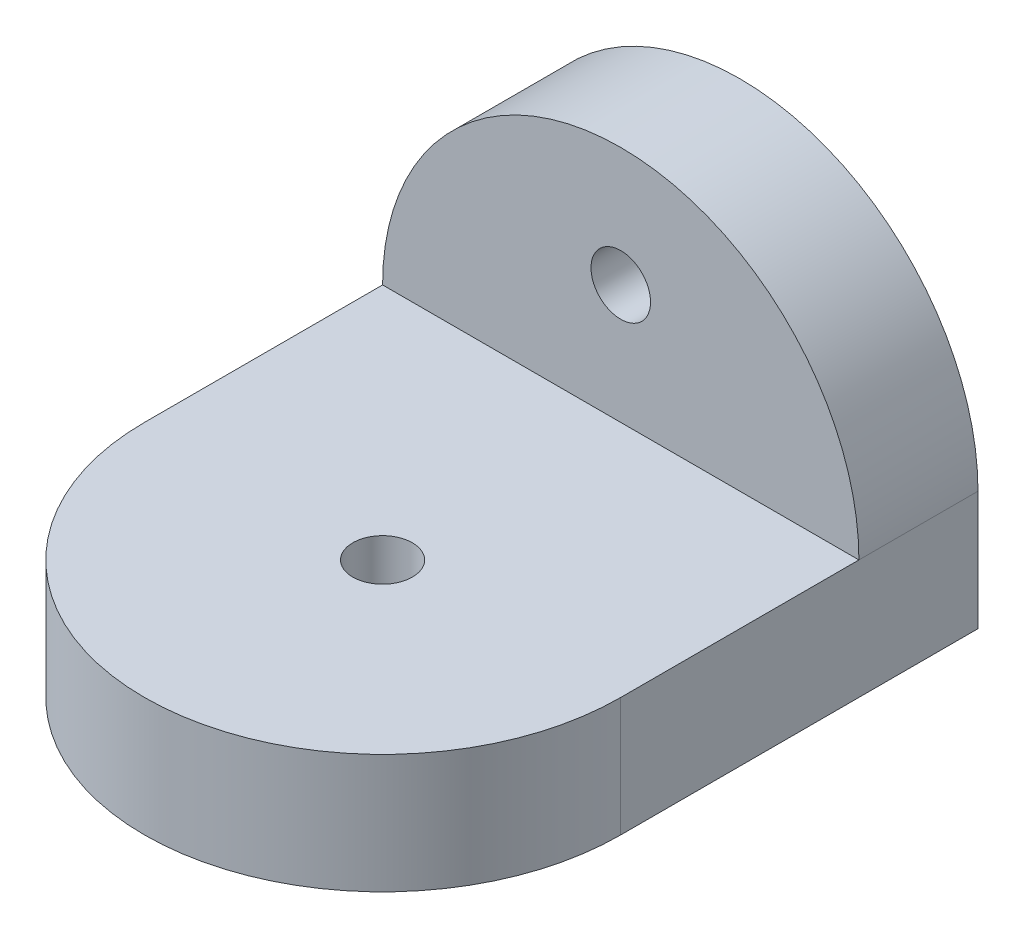
from build123d import *

# Parameters (mm, degrees)
Y_KSEKLIK_EKSTR_ZYON1_DEPTH = 5
Y_KSEKLIK_EKSTR_ZYON2_DEPTH = 5
IZIM3_R                     = 1.25
KES_EKSTR_ZYON1_DEPTH       = 5
IZIM4_R                     = 1.25
KES_EKSTR_ZYON2_DEPTH       = 5


with BuildPart() as part:
    # Çizim1 → Yükseklik-Ekstrüzyon1 (new body)
    with BuildSketch(Plane.XY):
        with BuildLine():
            Line((0, 0), (20, 0))
            ThreePointArc((20, 0), (10, 10), (0, 0))
        make_face()
    extrude(amount=Y_KSEKLIK_EKSTR_ZYON1_DEPTH)

    # Çizim2 → Yükseklik-Ekstrüzyon2 (add)
    with BuildSketch(Plane.XZ):
        with BuildLine():
            Line((0, 15), (0, 0))
            Line((0, 0), (20, 0))
            Line((20, 0), (20, 15))
            ThreePointArc((20, 15), (10, 25), (0, 15))
        make_face()
    extrude(amount=Y_KSEKLIK_EKSTR_ZYON2_DEPTH)

    # Çizim3 → Kes-Ekstrüzyon1 (cut)
    with BuildSketch(Plane.XY.offset(5)):
        with Locations((10, 5)):
            Circle(IZIM3_R)
    extrude(amount=-KES_EKSTR_ZYON1_DEPTH, mode=Mode.SUBTRACT)

    # Çizim4 → Kes-Ekstrüzyon2 (cut)
    with BuildSketch(Plane(origin=(0, 0, 0), x_dir=(1, 0, 0), z_dir=(0, 1, 0))):
        with Locations(Location((10, -15, 0), (0, 0, 270))):
            Circle(IZIM4_R)
    extrude(amount=-KES_EKSTR_ZYON2_DEPTH, mode=Mode.SUBTRACT)


solid = part.part
